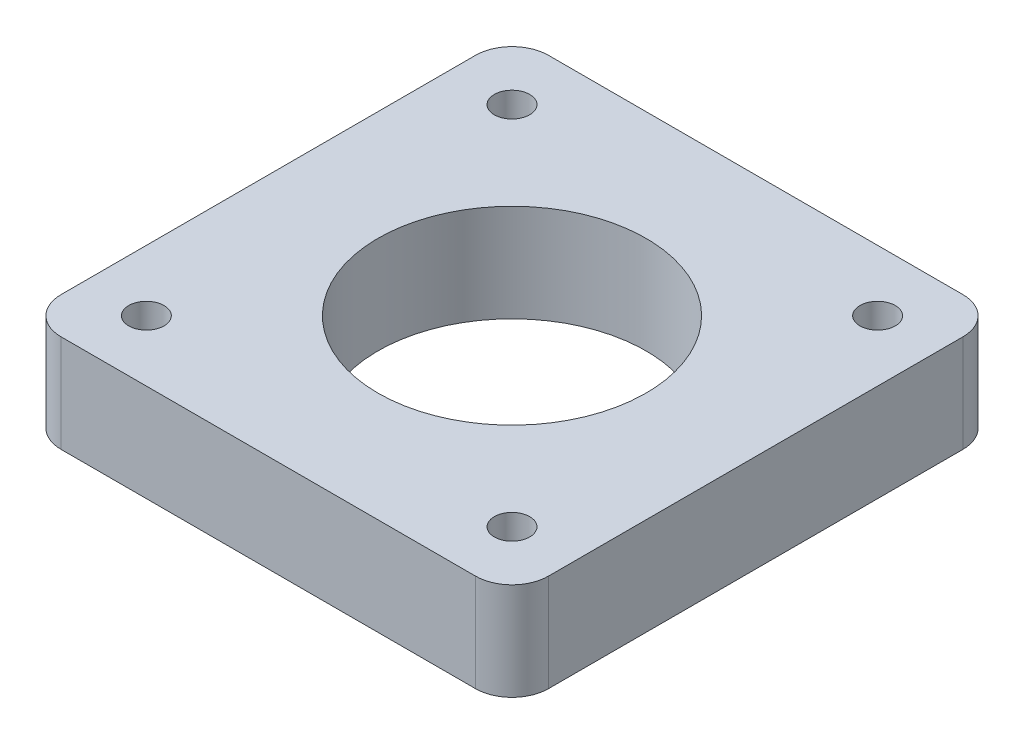
from build123d import *

# Parameters (mm, degrees)
SKETCH1_W           = 40
SKETCH1_H           = 40
SKETCH1_R           = 11
BOSS_EXTRUDE1_DEPTH = 8
SKETCH12_R          = 1.45
CUT_EXTRUDE1_DEPTH  = 58.053472861
FILLET1_R           = 3


with BuildPart() as part:
    # Sketch1 → Boss-Extrude1 (new body)
    with BuildSketch(Plane(origin=(0, 0, 0), x_dir=(1, 0, 0), z_dir=(0, 1, 0))):
        with Locations((20, -19.888579387)):
            Rectangle(SKETCH1_W, SKETCH1_H)
        with Locations(Location((20, -19.888579387, 0), (0, 0, 270))):
            Circle(SKETCH1_R, mode=Mode.SUBTRACT)
    extrude(amount=BOSS_EXTRUDE1_DEPTH)

    # Sketch12 → Cut-Extrude1 (cut, through all)
    with BuildSketch(Plane(origin=(0, 8, 0), x_dir=(1, 0, 0), z_dir=(0, 1, 0))):
        with Locations(Location((5, -4.888579387, 0), (0, 0, 270))):
            Circle(SKETCH12_R)
        with Locations(Location((35, -4.888579387, 0), (0, 0, 270))):
            Circle(SKETCH12_R)
        with Locations(Location((35, -34.888579387, 0), (0, 0, 270))):
            Circle(SKETCH12_R)
        with Locations(Location((5, -34.888579387, 0), (0, 0, 270))):
            Circle(SKETCH12_R)
    extrude(amount=-CUT_EXTRUDE1_DEPTH, mode=Mode.SUBTRACT)

    # Fillet1
    fillet1_edges = [part.edges().sort_by_distance(p)[0] for p in [
        (0, 4, -0.111420613),
        (40, 4, -0.111420613),
        (40, 4, 39.888579387),
        (0, 4, 39.888579387),
    ]]
    fillet(fillet1_edges, radius=FILLET1_R)


solid = part.part
